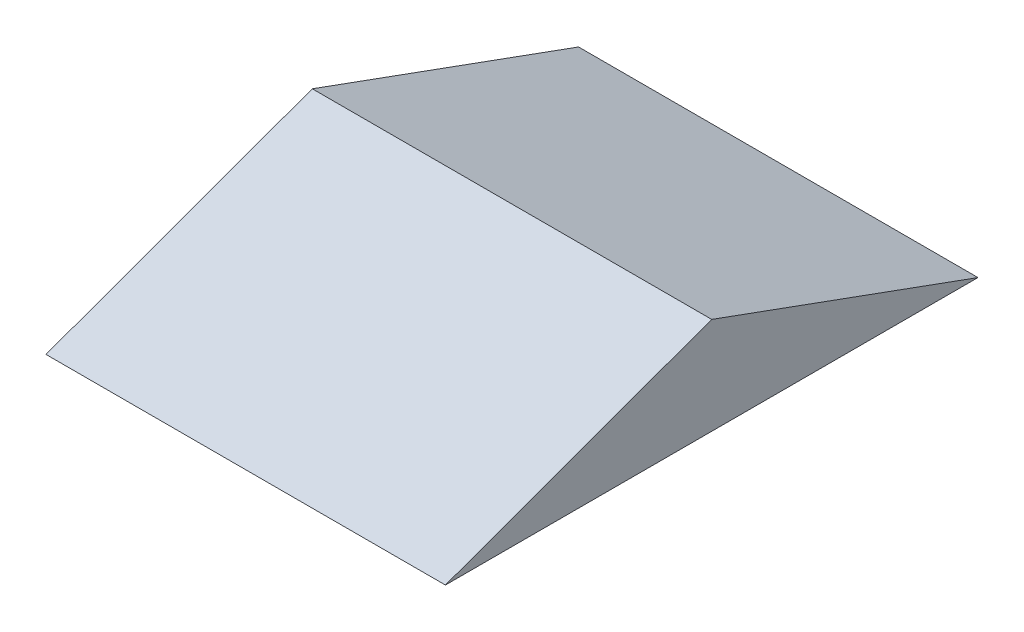
from build123d import *

# Parameters (mm, degrees)
EXTRUDE_1_DEPTH = 75


with BuildPart() as part:
    # Эскиз1 → Бобышка-Вытянуть1 (new, symmetric)
    with BuildSketch(Plane(origin=(0, 0, 0), x_dir=(0, 0, -1), z_dir=(1, 0, 0))):
        Polygon((-100, 0), (100, 0), (0, 36.397023427), align=None)
    extrude(amount=EXTRUDE_1_DEPTH, both=True)


solid = part.part
